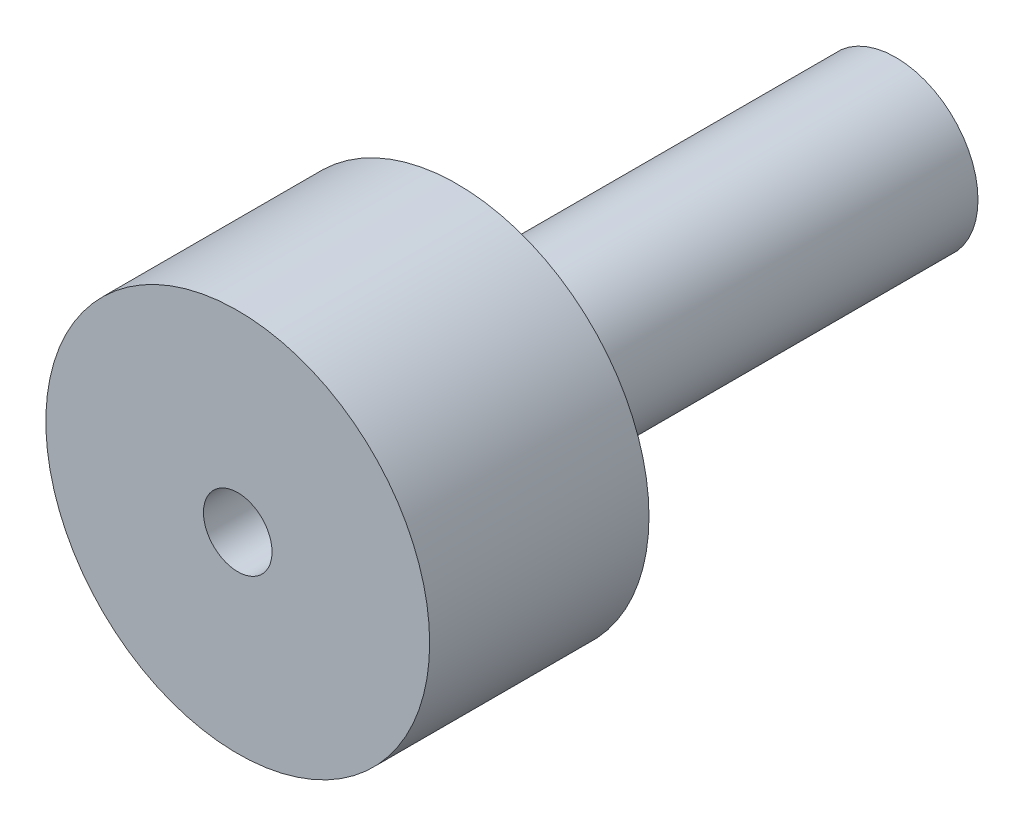
from build123d import *
from build123d.topology import SkipClean

# Parameters (mm, degrees)
SKETCH_1_R          = 14
SKETCH_1_R_2        = 2.5
EXTRUDE_1_DEPTH     = 16
SKETCH_2_R          = 6
EXTRUDE_2_DEPTH     = 32
CUT_EXTRUDE_1_REACH = 39.63
SKETCH_3_R          = 2.5


with BuildPart() as part:
    # 草图1 → 凸台-拉伸1 (new body)
    with BuildSketch(Plane.XY):
        Circle(SKETCH_1_R)
        Circle(SKETCH_1_R_2, mode=Mode.SUBTRACT)
    extrude(amount=EXTRUDE_1_DEPTH)

    # 草图2 → 凸台-拉伸2 (add)
    with BuildSketch(Plane(origin=(0, 0, 0), x_dir=(-1, 0, 0), z_dir=(0, 0, -1))):
        with Locations(Location((0, 0, 0), (0, 0, 180))):
            Circle(SKETCH_2_R)
    extrude(amount=EXTRUDE_2_DEPTH)

    # 草图3 → 切除-拉伸1 (cut, up to next)
    with BuildSketch(Plane.XY, mode=Mode.PRIVATE) as cut_extrude_1_sk1:
        with Locations(Location((0, 0, 0), (0, 0, 180))):
            Circle(SKETCH_3_R)
    cut_extrude_1_tool1 = extrude(cut_extrude_1_sk1.sketch, amount=-CUT_EXTRUDE_1_REACH, mode=Mode.PRIVATE) & part.part
    add(cut_extrude_1_tool1.solids().sort_by_distance((0, 0, 0))[0], mode=Mode.SUBTRACT)


solid = part.part
